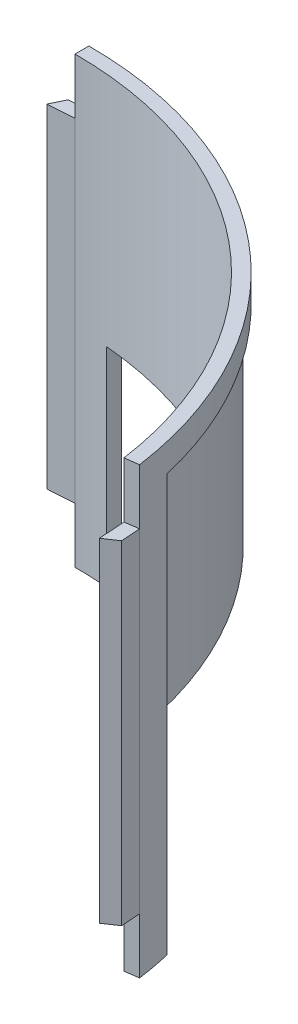
from build123d import *

# Parameters (mm, degrees)
EXTRUDE_1_DEPTH       = 800
EXTRUDE_2_DEPTH       = 300
MIRROR_3_COPY_1_DEPTH = 300
MIRROR_3_COPY_2_DEPTH = 300
CUT_EXTRUDE_1_DEPTH   = 750
CUT_EXTRUDE_2_DEPTH   = 375


with BuildPart() as part:
    # 草图1 → 凸台-拉伸1 (new body)
    with BuildSketch(Plane(origin=(0, 0, 0), x_dir=(1, 0, 0), z_dir=(0, 1, 0))):
        with BuildLine():
            Line((0, 705), (0, 680))
            ThreePointArc((0, 680), (446.120139714, 513.202514551), (673.382286744, 94.637708653))
            Line((673.382286744, 94.637708653), (698.138988463, 98.117036177))
            ThreePointArc((698.138988463, 98.117036177), (462.521615438, 532.070254057), (0, 705))
        make_face()
    extrude(amount=EXTRUDE_1_DEPTH)

    # 草图2 → 凸台-拉伸2 (add)
    with BuildSketch(Plane(origin=(0, 400, 0), x_dir=(1, 0, 0), z_dir=(0, 1, 0))):
        Polygon((698.138988463, 98.117036177), (673.382286744, 94.637708653), (676.691143372, 47.318854326), (700.56509889, 63.422040654), align=None)
    extrude_2 = extrude(amount=-EXTRUDE_2_DEPTH)

    # 镜向1: 凸台-拉伸2 across plane
    add(extrude_2.mirror(Plane(origin=(446.120139714, 800, -513.202514551), x_dir=(-0.6560590289905062, 0, 0.754709580222773), z_dir=(-0.7547095802227732, 0, -0.656059028990506))))

    # 镜向2: 凸台-拉伸2 across plane
    add(extrude_2.mirror(Plane.ZX.offset(400)))

    # 镜向3 copy 1 sketch → 镜向3 copy 1 (add)
    with BuildSketch(Plane(origin=(0, 400, 0), x_dir=(-0.13917310096006918, 0, -0.99026806874157), z_dir=(0, -1, 0))):
        Polygon((698.138988463, 98.117036177), (673.382286744, 94.637708653), (676.691143372, 47.318854326), (700.56509889, 63.422040654), align=None)
    extrude(amount=-MIRROR_3_COPY_1_DEPTH)

    # 镜向3 copy 2 sketch → 镜向3 copy 2 (add)
    with BuildSketch(Plane(origin=(0, 400, 0), x_dir=(-0.13917310096006918, 0, -0.99026806874157), z_dir=(0, 1, 0))):
        Polygon((698.138988463, -98.117036177), (673.382286744, -94.637708653), (676.691143372, -47.318854326), (700.56509889, -63.422040654), align=None)
    extrude(amount=-MIRROR_3_COPY_2_DEPTH)

    # 草图4 → 切除-拉伸1 (cut)
    with BuildSketch(Plane.XZ):
        with BuildLine():
            Line((677.274077507, -155.96417517), (687.019028263, -158.208264022))
            ThreePointArc((687.019028263, -158.208264022), (462.521615438, -532.070254057), (61.05402349, -702.351341008))
            Line((61.05402349, -702.351341008), (60.188008972, -692.388910639))
            ThreePointArc((60.188008972, -692.388910639), (455.961025148, -524.523158255), (677.274077507, -155.96417517))
        make_face()
    extrude(amount=-CUT_EXTRUDE_1_DEPTH, mode=Mode.SUBTRACT)

    # 草图5 → 切除-拉伸2 (cut)
    with BuildSketch(Plane.XZ):
        with BuildLine():
            Line((677.274077507, -155.96417517), (662.656651374, -152.598041893))
            ThreePointArc((662.656651374, -152.598041893), (446.120139714, -513.202514551), (58.888987196, -677.445265086))
            Line((58.888987196, -677.445265086), (60.188008972, -692.388910639))
            ThreePointArc((60.188008972, -692.388910639), (455.961025148, -524.523158255), (677.274077507, -155.96417517))
        make_face()
    extrude(amount=-CUT_EXTRUDE_2_DEPTH, mode=Mode.SUBTRACT)


solid = part.part
